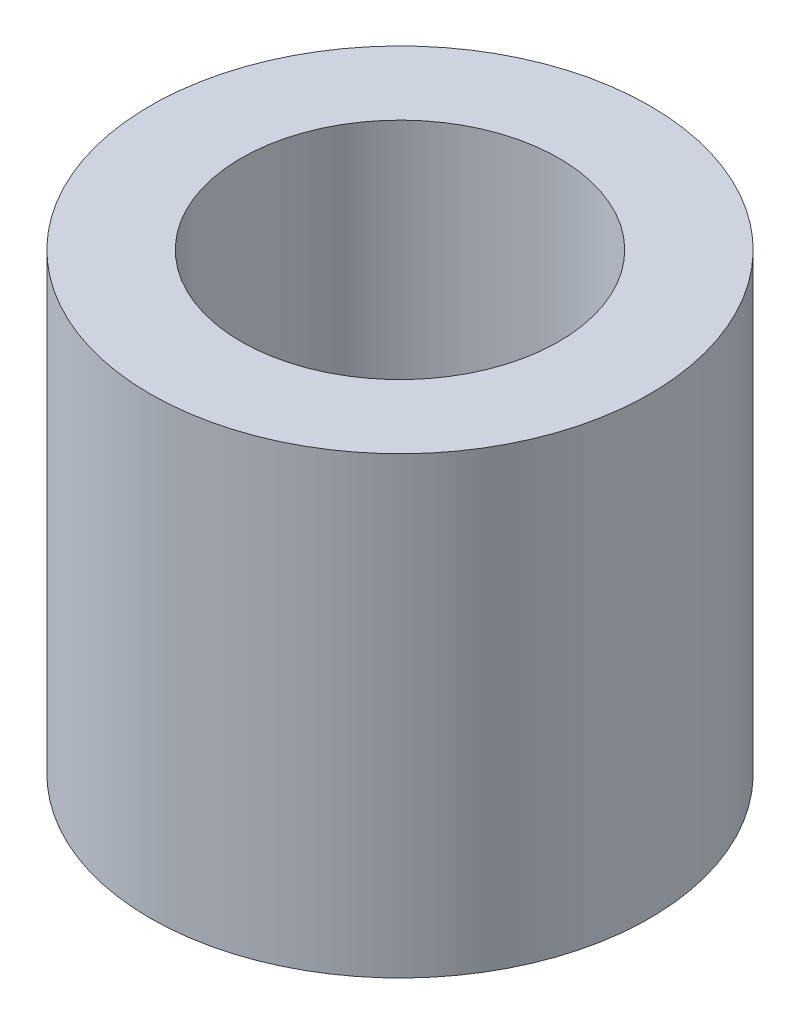
from build123d import *

# Parameters (mm, degrees)
ESQUISSE1_R        = 5.5
ESQUISSE1_R_2      = 3.5
BOSS_EXTRU_1_DEPTH = 10


with BuildPart() as part:
    # Esquisse1 → Boss.-Extru.1 (new body)
    with BuildSketch(Plane(origin=(0, 0, 0), x_dir=(1, 0, 0), z_dir=(0, 1, 0))):
        with Locations(Location((0, 0, 0), (0, 0, 270))):
            Circle(ESQUISSE1_R)
        with Locations(Location((0, 0, 0), (0, 0, 270))):
            Circle(ESQUISSE1_R_2, mode=Mode.SUBTRACT)
    extrude(amount=BOSS_EXTRU_1_DEPTH)


solid = part.part
